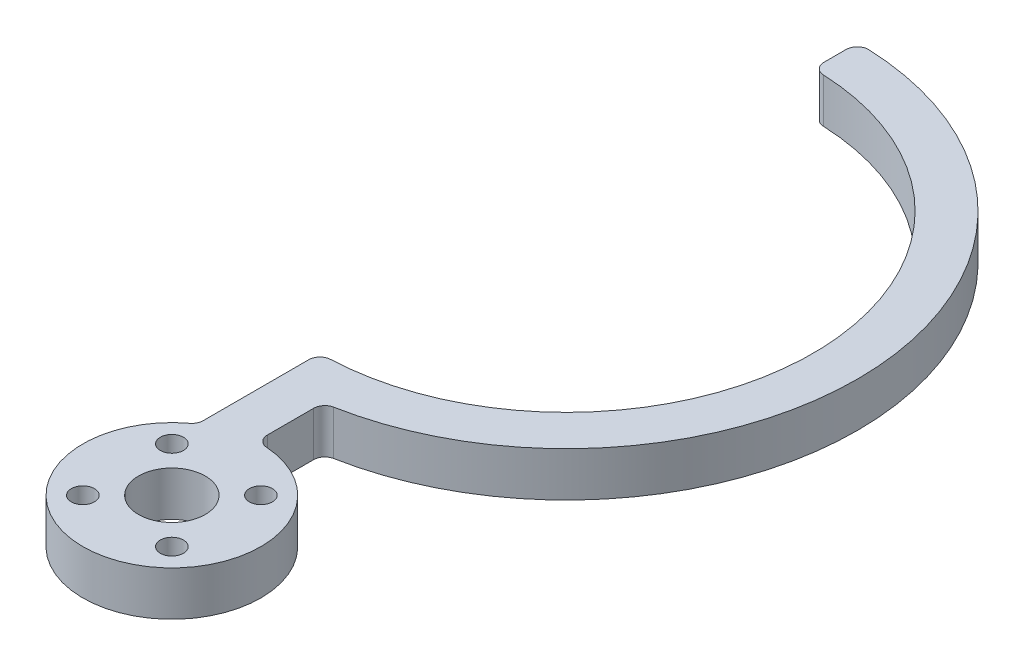
from build123d import *

# Parameters (mm, degrees)
SKETCH1_R           = 2.075
SKETCH1_R_2         = 6.003208263
BOSS_EXTRUDE2_DEPTH = 8
FILLET1_R           = 2


with BuildPart() as part:
    # Sketch1 → Boss-Extrude2 (new body)
    with BuildSketch(Plane(origin=(0, 0, 0), x_dir=(1, 0, 0), z_dir=(0, 1, 0))):
        with BuildLine():
            Line((0, 52.33), (0, 44.33))
            ThreePointArc((0, 44.33), (44.33, 0), (0, -44.33))
            Line((0, -44.33), (0, -54.33))
            Line((0, -54.33), (0, -66.33))
            ThreePointArc((0, -66.33), (13.767694167, -94.903125951), (8, -63.714880837))
            Line((8, -63.714880837), (8, -51.714880837))
            ThreePointArc((8, -51.714880837), (52.17599359, 4.011806687), (0, 52.33))
        make_face()
        with Locations(Location((0.79632837, -71.69505171, 0), (0, 0, 270))):
            Circle(SKETCH1_R, mode=Mode.SUBTRACT)
        with Locations(Location((16.79632837, -71.69505171, 0), (0, 0, 270))):
            Circle(SKETCH1_R, mode=Mode.SUBTRACT)
        with Locations(Location((16.79632837, -87.69505171, 0), (0, 0, 270))):
            Circle(SKETCH1_R, mode=Mode.SUBTRACT)
        with Locations(Location((0.79632837, -87.69505171, 0), (0, 0, 270))):
            Circle(SKETCH1_R, mode=Mode.SUBTRACT)
        with Locations(Location((8.79632837, -79.69505171, 0), (0, 0, 270))):
            Circle(SKETCH1_R_2, mode=Mode.SUBTRACT)
    extrude(amount=BOSS_EXTRUDE2_DEPTH)

    # Fillet1
    fillet1_edges = [part.edges().sort_by_distance(p)[0] for p in [
        (0, 4, 66.33),
        (0, 4, 44.33),
        (0, 4, -44.33),
        (0, 4, -52.33),
        (8, 4, 51.714880837),
        (8, 4, 63.714880837),
    ]]
    fillet(fillet1_edges, radius=FILLET1_R)


solid = part.part
